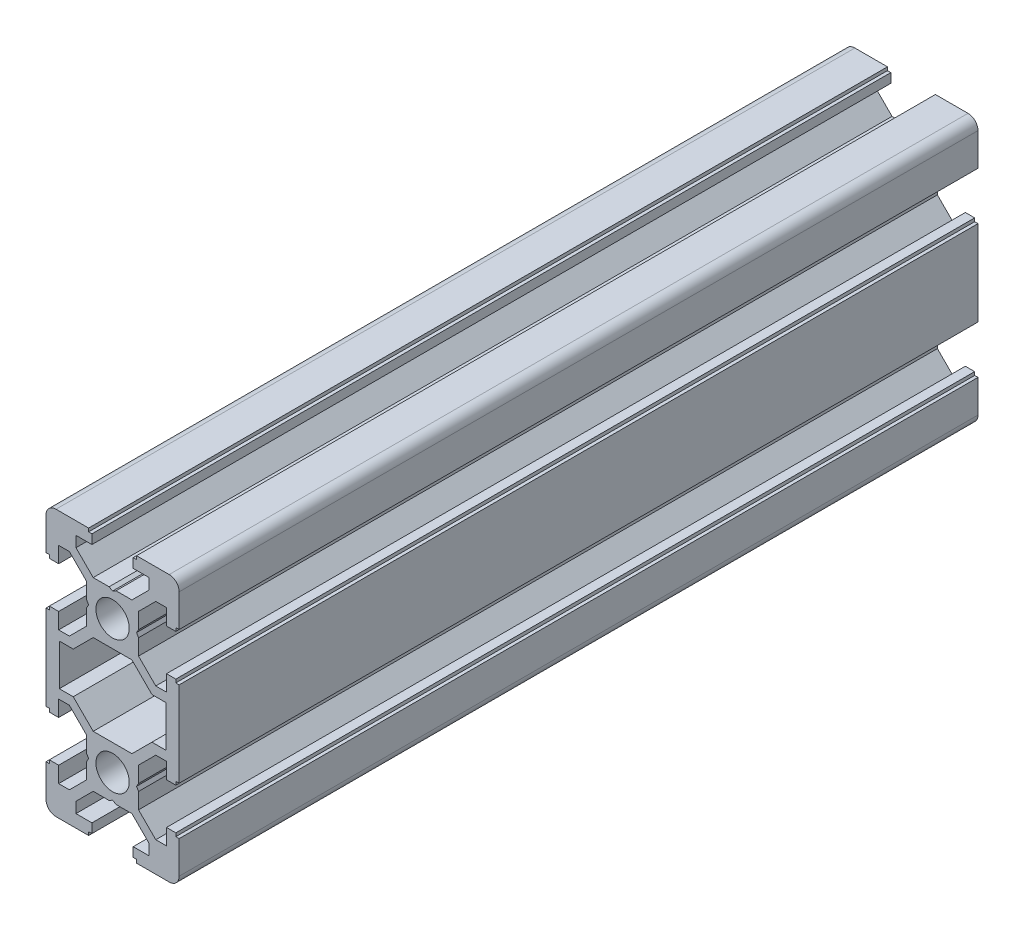
from build123d import *

# Parameters (mm, degrees)
MODEL_R         = 2.5
EXTRUDE_1_DEPTH = 120


with BuildPart() as part:
    # Model → 凸台-拉伸1 (new body)
    with BuildSketch(Plane.XY):
        with BuildLine():
            Line((-3.6, 10), (-3.9, 9.480384758))
            Line((-3.9, 9.480384758), (-3.9, 7.089949494))
            Line((-3.9, 7.089949494), (-6.489949494, 4.5))
            Line((-6.489949494, 4.5), (-8.1, 4.5))
            Line((-8.1, 4.5), (-8.1, 6.9))
            Line((-8.1, 6.9), (-9.5, 6.9))
            Line((-9.5, 6.9), (-9.5, 6.4))
            Line((-9.5, 6.4), (-10, 6.4))
            Line((-10, 6.4), (-10, -6.4))
            Line((-10, -6.4), (-9.5, -6.4))
            Line((-9.5, -6.4), (-9.5, -6.9))
            Line((-9.5, -6.9), (-8.1, -6.9))
            Line((-8.1, -6.9), (-8.1, -4.5))
            Line((-8.1, -4.5), (-6.489949494, -4.5))
            Line((-6.489949494, -4.5), (-3.9, -7.089949494))
            Line((-3.9, -7.089949494), (-3.9, -9.480384758))
            Line((-3.9, -9.480384758), (-3.6, -10))
            Line((-3.6, -10), (-3.9, -10.519615242))
            Line((-3.9, -10.519615242), (-3.9, -12.910050506))
            Line((-3.9, -12.910050506), (-6.489949494, -15.5))
            Line((-6.489949494, -15.5), (-8.1, -15.5))
            Line((-8.1, -15.5), (-8.1, -13.1))
            Line((-8.1, -13.1), (-9.5, -13.1))
            Line((-9.5, -13.1), (-9.5, -13.6))
            Line((-9.5, -13.6), (-10, -13.6))
            Line((-10, -13.6), (-10, -18.5))
            ThreePointArc((-10, -18.5), (-9.560660172, -19.560660172), (-8.5, -20))
            Line((-8.5, -20), (-3.6, -20))
            Line((-3.6, -20), (-3.6, -19.5))
            Line((-3.6, -19.5), (-3.1, -19.5))
            Line((-3.1, -19.5), (-3.1, -18.1))
            Line((-3.1, -18.1), (-5.5, -18.1))
            Line((-5.5, -18.1), (-5.5, -16.489949494))
            Line((-5.5, -16.489949494), (-2.910050506, -13.9))
            Line((-2.910050506, -13.9), (-0.519615242, -13.9))
            Line((-0.519615242, -13.9), (0, -13.6))
            Line((0, -13.6), (0.519615242, -13.9))
            Line((0.519615242, -13.9), (2.910050506, -13.9))
            Line((2.910050506, -13.9), (5.5, -16.489949494))
            Line((5.5, -16.489949494), (5.5, -18.1))
            Line((5.5, -18.1), (3.1, -18.1))
            Line((3.1, -18.1), (3.1, -19.5))
            Line((3.1, -19.5), (3.6, -19.5))
            Line((3.6, -19.5), (3.6, -20))
            Line((3.6, -20), (8.5, -20))
            ThreePointArc((8.5, -20), (9.560660172, -19.560660172), (10, -18.5))
            Line((10, -18.5), (10, -13.6))
            Line((10, -13.6), (9.5, -13.6))
            Line((9.5, -13.6), (9.5, -13.1))
            Line((9.5, -13.1), (8.1, -13.1))
            Line((8.1, -13.1), (8.1, -15.5))
            Line((8.1, -15.5), (6.489949494, -15.5))
            Line((6.489949494, -15.5), (3.9, -12.910050506))
            Line((3.9, -12.910050506), (3.9, -10.519615242))
            Line((3.9, -10.519615242), (3.6, -10))
            Line((3.6, -10), (3.9, -9.480384758))
            Line((3.9, -9.480384758), (3.9, -7.089949494))
            Line((3.9, -7.089949494), (6.489949494, -4.5))
            Line((6.489949494, -4.5), (8.1, -4.5))
            Line((8.1, -4.5), (8.1, -6.9))
            Line((8.1, -6.9), (9.5, -6.9))
            Line((9.5, -6.9), (9.5, -6.4))
            Line((9.5, -6.4), (10, -6.4))
            Line((10, -6.4), (10, 6.4))
            Line((10, 6.4), (9.5, 6.4))
            Line((9.5, 6.4), (9.5, 6.9))
            Line((9.5, 6.9), (8.1, 6.9))
            Line((8.1, 6.9), (8.1, 4.5))
            Line((8.1, 4.5), (6.489949494, 4.5))
            Line((6.489949494, 4.5), (3.9, 7.089949494))
            Line((3.9, 7.089949494), (3.9, 9.480384758))
            Line((3.9, 9.480384758), (3.6, 10))
            Line((3.6, 10), (3.9, 10.519615242))
            Line((3.9, 10.519615242), (3.9, 12.910050506))
            Line((3.9, 12.910050506), (6.489949494, 15.5))
            Line((6.489949494, 15.5), (8.1, 15.5))
            Line((8.1, 15.5), (8.1, 13.1))
            Line((8.1, 13.1), (9.5, 13.1))
            Line((9.5, 13.1), (9.5, 13.6))
            Line((9.5, 13.6), (10, 13.6))
            Line((10, 13.6), (10, 18.5))
            ThreePointArc((10, 18.5), (9.560660172, 19.560660172), (8.5, 20))
            Line((8.5, 20), (3.6, 20))
            Line((3.6, 20), (3.6, 19.5))
            Line((3.6, 19.5), (3.1, 19.5))
            Line((3.1, 19.5), (3.1, 18.1))
            Line((3.1, 18.1), (5.5, 18.1))
            Line((5.5, 18.1), (5.5, 16.489949494))
            Line((5.5, 16.489949494), (2.910050506, 13.9))
            Line((2.910050506, 13.9), (0.519615242, 13.9))
            Line((0.519615242, 13.9), (0, 13.6))
            Line((0, 13.6), (-0.519615242, 13.9))
            Line((-0.519615242, 13.9), (-2.910050506, 13.9))
            Line((-2.910050506, 13.9), (-5.5, 16.489949494))
            Line((-5.5, 16.489949494), (-5.5, 18.1))
            Line((-5.5, 18.1), (-3.1, 18.1))
            Line((-3.1, 18.1), (-3.1, 19.5))
            Line((-3.1, 19.5), (-3.6, 19.5))
            Line((-3.6, 19.5), (-3.6, 20))
            Line((-3.6, 20), (-8.5, 20))
            ThreePointArc((-8.5, 20), (-9.560660172, 19.560660172), (-10, 18.5))
            Line((-10, 18.5), (-10, 13.6))
            Line((-10, 13.6), (-9.5, 13.6))
            Line((-9.5, 13.6), (-9.5, 13.1))
            Line((-9.5, 13.1), (-8.1, 13.1))
            Line((-8.1, 13.1), (-8.1, 15.5))
            Line((-8.1, 15.5), (-6.489949494, 15.5))
            Line((-6.489949494, 15.5), (-3.9, 12.910050506))
            Line((-3.9, 12.910050506), (-3.9, 10.519615242))
            Line((-3.9, 10.519615242), (-3.6, 10))
        make_face()
        with Locations((0, 10)):
            Circle(MODEL_R, mode=Mode.SUBTRACT)
        with Locations((0, -10)):
            Circle(MODEL_R, mode=Mode.SUBTRACT)
        Polygon((8, -3.1), (5.910050506, -3.1), (2.910050506, -6.1), (-2.910050506, -6.1), (-5.910050506, -3.1), (-8, -3.1), (-8, 3.1), (-5.910050506, 3.1), (-2.910050506, 6.1), (2.910050506, 6.1), (5.910050506, 3.1), (8, 3.1), align=None, mode=Mode.SUBTRACT)
    extrude(amount=EXTRUDE_1_DEPTH)


solid = part.part
